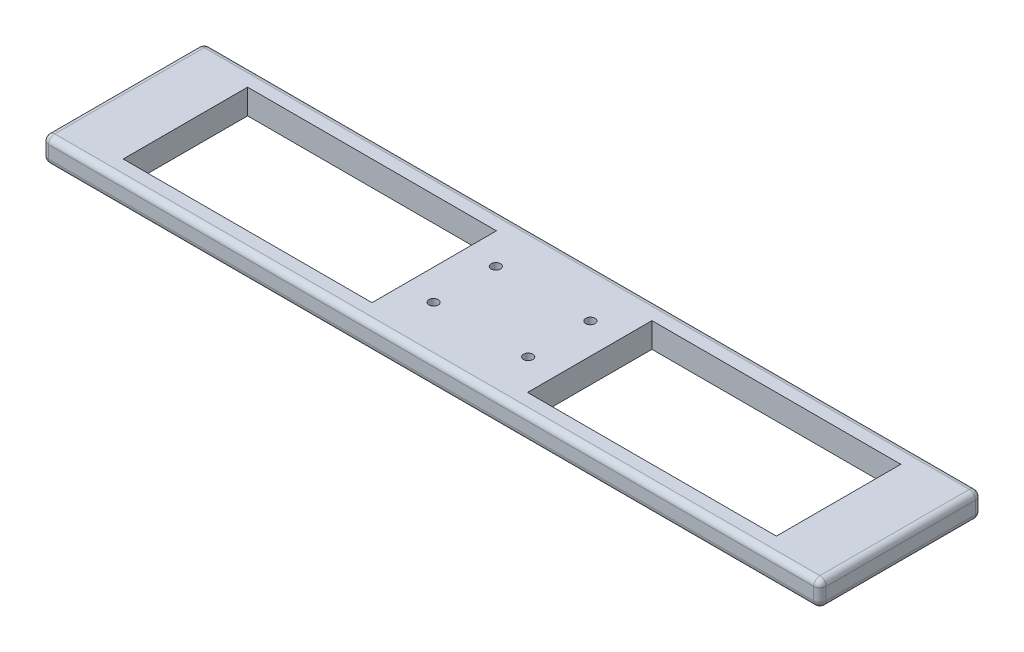
from build123d import *

# Parameters (mm, degrees)
SKETCH1_W                 = 125
SKETCH1_H                 = 26
BOSS_EXTRUDE1_DEPTH       = 4
SKETCH2_W                 = 40
SKETCH2_H                 = 20
CUT_EXTRUDE1_DEPTH        = 4
FILLET5_R                 = 1
F_1_5MM_DOWEL_HOLE1_D     = 1.5
F_1_5MM_DOWEL_HOLE1_DEPTH = 8
F_1_5MM_DOWEL_HOLE1_TIP   = 0.450645464


with BuildPart() as part:
    # Sketch1 → Boss-Extrude1 (new body)
    with BuildSketch(Plane(origin=(0, 0, 0), x_dir=(1, 0, 0), z_dir=(0, 1, 0))):
        with Locations((62.5, 13)):
            Rectangle(SKETCH1_W, SKETCH1_H)
    extrude(amount=BOSS_EXTRUDE1_DEPTH)

    # Sketch2 → Cut-Extrude1 (cut)
    with BuildSketch(Plane(origin=(0, 4, 0), x_dir=(1, 0, 0), z_dir=(0, 1, 0))):
        with Locations((30, 13)):
            Rectangle(SKETCH2_W, SKETCH2_H)
        with Locations((95, 13)):
            Rectangle(SKETCH2_W, SKETCH2_H)
    extrude(amount=-CUT_EXTRUDE1_DEPTH, mode=Mode.SUBTRACT)

    # Fillet5
    fillet5_edges = [part.edges().sort_by_distance(p)[0] for p in [
        (125, 4, -13),
        (62.5, 4, -26),
        (0, 4, -13),
        (62.5, 0, -26),
        (125, 0, -13),
        (62.5, 0, 0),
        (0, 0, -13),
        (0, 2, -26),
        (125, 2, -26),
        (125, 2, 0),
        (0, 2, 0),
        (62.5, 4, 0),
    ]]
    fillet(fillet5_edges, radius=FILLET5_R)

    # Ø1.5mm Dowel Hole1
    with Locations(Plane(origin=(0, 4, 0), x_dir=(1, 0, 0), z_dir=(0, 1, 0))):
        with Locations((54.9, 8), (54.9, 18), (70.1, 18), (70.1, 8)):
            Hole(F_1_5MM_DOWEL_HOLE1_D / 2, depth=F_1_5MM_DOWEL_HOLE1_DEPTH)
            with Locations((0, 0, -(F_1_5MM_DOWEL_HOLE1_DEPTH + F_1_5MM_DOWEL_HOLE1_TIP / 2))):  # 118° drill point
                Cone(0, F_1_5MM_DOWEL_HOLE1_D / 2, F_1_5MM_DOWEL_HOLE1_TIP, mode=Mode.SUBTRACT)


solid = part.part
